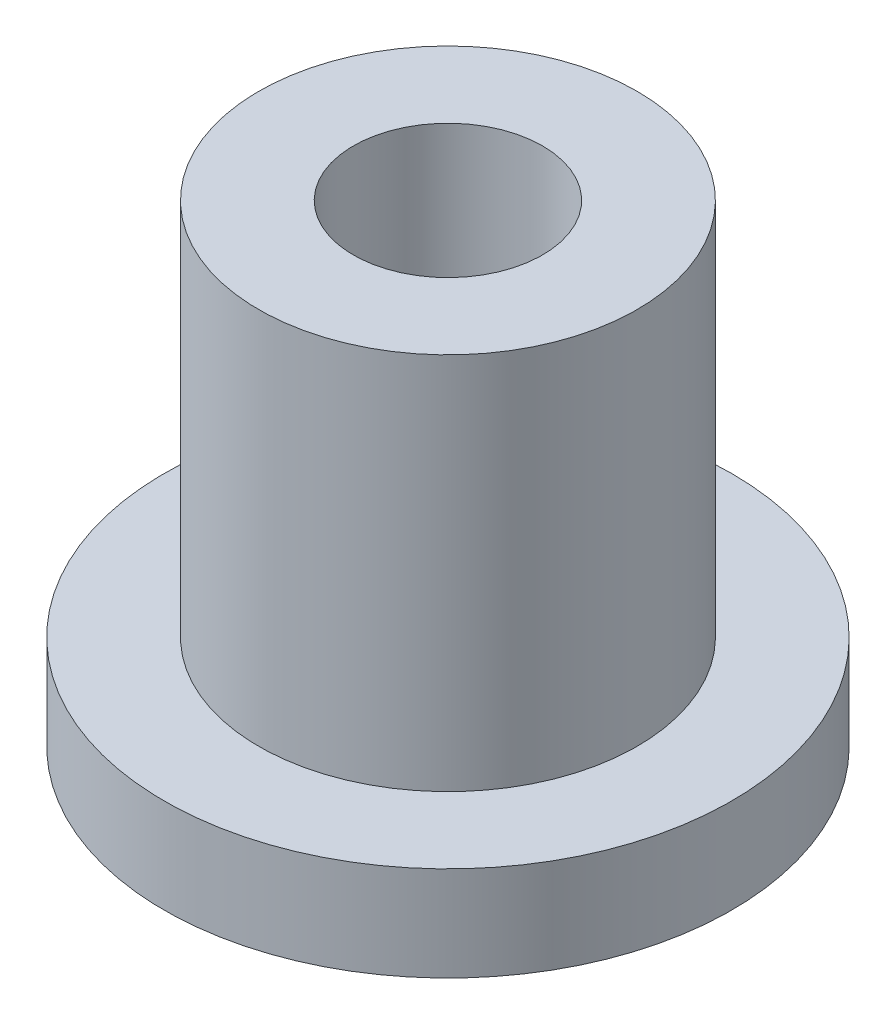
from build123d import *


with BuildPart() as part:
    # Croquis1 → Revolución1 (revolve)
    with BuildSketch(Plane.XY, mode=Mode.PRIVATE) as revoluci_n1_sk:
        Polygon((-2, 10), (-2, 0), (-6, 0), (-6, 2), (-4, 2), (-4, 10), align=None)
    revolve(revoluci_n1_sk.sketch.rotate(Axis((0, 0, 0), (0, 1, 0)), 270), axis=Axis((0, 0, 0), (0, 1, 0)))


solid = part.part
